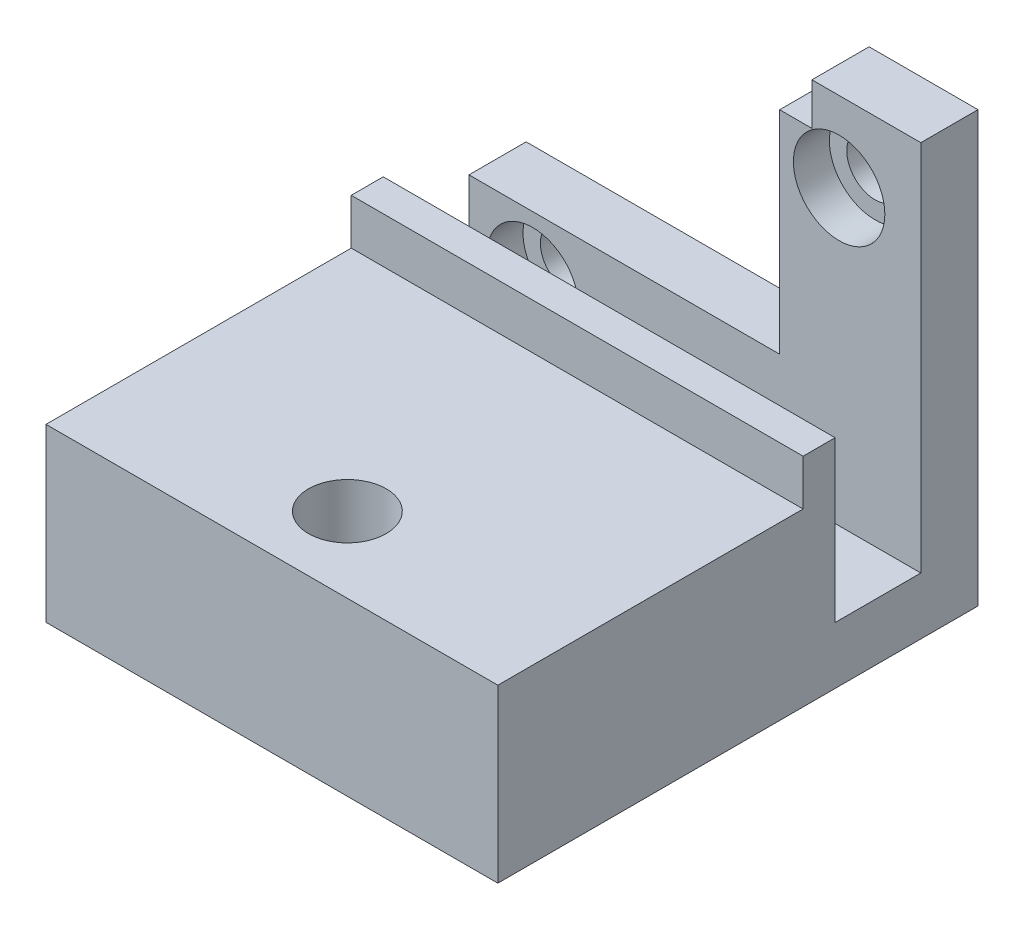
from build123d import *

# Parameters (mm, degrees)
SKETCH2_R           = 1.5748
SKETCH2_W           = 1
SKETCH2_H           = 6.604
BOSS_EXTRUDE1_DEPTH = 3.175
SKETCH3_W           = 25.098
SKETCH3_H           = 3.175
BOSS_EXTRUDE3_DEPTH = 26.67
SKETCH5_R           = 2.54
CUT_EXTRUDE2_DEPTH  = 2
SKETCH6_W           = 25.098
SKETCH6_H           = 18.7325
BOSS_EXTRUDE4_DEPTH = 6.35
SKETCH4_R           = 2.159
CUT_EXTRUDE3_DEPTH  = 39.036194564
SKETCH7_W           = 25.098
SKETCH7_H           = 1.778
BOSS_EXTRUDE5_DEPTH = 2.54


with BuildPart() as part:
    # Sketch2 → Boss-Extrude1 (new body)
    # profile 1 of 2: a face of its own
    with BuildSketch(Plane.XY):
        Polygon((4.395213829, 10.321811953), (4.395213829, 7.827388121), (4.395213829, -1.438404904), (-11.860786171, -1.438404904), (-11.860786171, -8.042404904), (12.237213829, -8.042404904), (12.237213829, 12.658595096), (7.697213829, 12.658595096), (6.188170382, 12.658595096), (6.188170382, 10.321811953), align=None)
        with Locations((-9.320786171, -4.740404904)):
            Circle(SKETCH2_R, mode=Mode.SUBTRACT)
        with Locations((7.697213829, 8.213595096)):
            Circle(SKETCH2_R, mode=Mode.SUBTRACT)
    # profile 2 of 2: a face of its own
    with BuildSketch(Plane.XY):
        with Locations((-12.360786171, -4.740404904)):
            Rectangle(SKETCH2_W, SKETCH2_H)
    extrude(amount=BOSS_EXTRUDE1_DEPTH)

    # Sketch3 → Boss-Extrude3 (add)
    with BuildSketch(Plane(origin=(0, 0, 0), x_dir=(-1, 0, 0), z_dir=(0, 0, -1))):
        with Locations((0.311786171, -9.629904904)):
            Rectangle(SKETCH3_W, SKETCH3_H)
    extrude(amount=-BOSS_EXTRUDE3_DEPTH)

    # Sketch5 → Cut-Extrude2 (cut)
    with BuildSketch(Plane.XY.offset(3.175)):
        with Locations((7.697213829, 8.213595096)):
            Circle(SKETCH5_R)
        with Locations((-9.320786171, -4.740404904)):
            Circle(SKETCH5_R)
    extrude(amount=-CUT_EXTRUDE2_DEPTH, mode=Mode.SUBTRACT)

    # Sketch6 → Boss-Extrude4 (add)
    with BuildSketch(Plane(origin=(0, -8.042404904, 0), x_dir=(1, 0, 0), z_dir=(0, 1, 0))):
        with Locations((-0.311786171, -17.30375)):
            Rectangle(SKETCH6_W, SKETCH6_H)
    extrude(amount=BOSS_EXTRUDE4_DEPTH)

    # Sketch4 → Cut-Extrude3 (cut, through all)
    with BuildSketch(Plane.XZ.offset(11.217404904)):
        with Locations(Location((-0.311786171, 22.479, 0), (0, 0, 270))):
            Circle(SKETCH4_R)
    extrude(amount=-CUT_EXTRUDE3_DEPTH, mode=Mode.SUBTRACT)

    # Sketch7 → Boss-Extrude5 (add)
    with BuildSketch(Plane(origin=(0, -1.692404904, 0), x_dir=(1, 0, 0), z_dir=(0, 1, 0))):
        with Locations((-0.311786171, -8.8265)):
            Rectangle(SKETCH7_W, SKETCH7_H)
    extrude(amount=BOSS_EXTRUDE5_DEPTH)


solid = part.part
